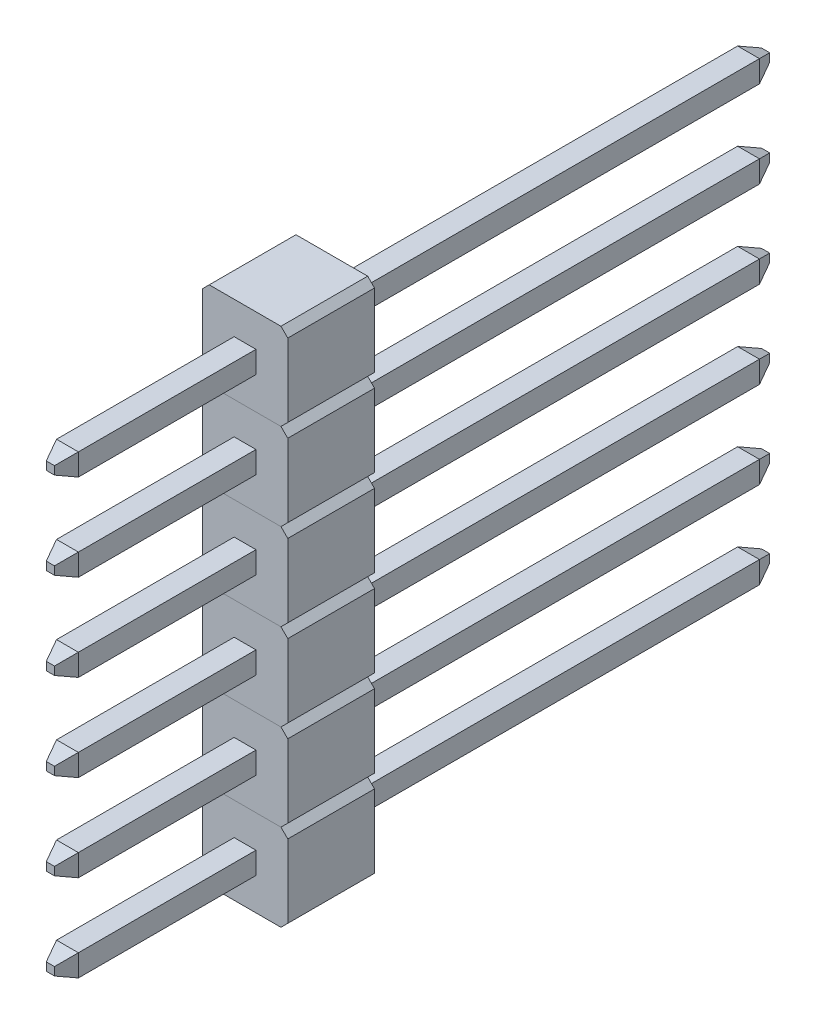
from build123d import *
from OCP.BRepFilletAPI import BRepFilletAPI_MakeChamfer

# Parameters (mm, degrees)
ESQUISSE1_W                = 2.5
ESQUISSE1_H                = 2.54
BASE_DEPTH                 = 2.54
ESQUISSE3_W                = 0.64
ESQUISSE3_H                = 0.64
EXTRUDE_A_DEPTH            = 5.7
ESQUISSE4_W                = 0.64
ESQUISSE4_H                = 0.64
EXTRUDE_B_DEPTH            = 12.7
CHANFREIN2_SIZE            = 0.2
CHANFREIN3_SIZE            = 0.5
CHANFREIN3_SIZE2           = 0.2
R_P_TITION_LIN_AIRE2_COUNT = 6
R_P_TITION_LIN_AIRE2_PITCH = 2.54


with BuildPart() as part:
    # Esquisse1 → Base (new body)
    with BuildSketch(Plane.XY):
        Rectangle(ESQUISSE1_W, ESQUISSE1_H)
    extrude(amount=BASE_DEPTH)

    # Esquisse3 → A (add)
    with BuildSketch(Plane.XY.offset(2.54)):
        Rectangle(ESQUISSE3_W, ESQUISSE3_H)
    extrude(amount=EXTRUDE_A_DEPTH)

    # Esquisse4 → B (add)
    with BuildSketch(Plane(origin=(0, 0, 0), x_dir=(-1, 0, 0), z_dir=(0, 0, -1))):
        Rectangle(ESQUISSE4_W, ESQUISSE4_H)
    extrude(amount=EXTRUDE_B_DEPTH)

    # Chanfrein2
    chanfrein2_edges = [part.edges().sort_by_distance(p)[0] for p in [
        (1.25, -1.27, 1.27),
        (-1.25, -1.27, 1.27),
        (-1.25, 1.27, 1.27),
        (1.25, 1.27, 1.27),
    ]]
    chamfer(chanfrein2_edges, length=CHANFREIN2_SIZE)

    # Chanfrein3: one chamfer whose edges measure the first distance from different faces: ONE call of the kernel's chamfer builder (chamfer() names one face for all edges)
    chanfrein3_edges_1 = [part.edges().sort_by_distance(p)[0] for p in [
        (0.32, 0, 8.24),
    ]]
    chanfrein3_side_1 = [part.faces().sort_by_distance(p)[0] for p in [
        (0.32, 0, 5.39),
    ]]
    chanfrein3_edges_2 = [part.edges().sort_by_distance(p)[0] for p in [
        (0, 0.32, 8.24),
    ]]
    chanfrein3_side_2 = [part.faces().sort_by_distance(p)[0] for p in [
        (0, 0.32, 5.39),
    ]]
    chanfrein3_edges_3 = [part.edges().sort_by_distance(p)[0] for p in [
        (-0.32, 0, 8.24),
    ]]
    chanfrein3_side_3 = [part.faces().sort_by_distance(p)[0] for p in [
        (-0.32, 0, 5.39),
    ]]
    chanfrein3_edges_4 = [part.edges().sort_by_distance(p)[0] for p in [
        (0, -0.32, 8.24),
    ]]
    chanfrein3_side_4 = [part.faces().sort_by_distance(p)[0] for p in [
        (0, -0.32, 5.39),
    ]]
    chanfrein3_edges_5 = [part.edges().sort_by_distance(p)[0] for p in [
        (-0.32, 0, -12.7),
    ]]
    chanfrein3_side_5 = [part.faces().sort_by_distance(p)[0] for p in [
        (-0.32, 0, -6.35),
    ]]
    chanfrein3_edges_6 = [part.edges().sort_by_distance(p)[0] for p in [
        (0, 0.32, -12.7),
    ]]
    chanfrein3_side_6 = [part.faces().sort_by_distance(p)[0] for p in [
        (0, 0.32, -6.35),
    ]]
    chanfrein3_edges_7 = [part.edges().sort_by_distance(p)[0] for p in [
        (0.32, 0, -12.7),
    ]]
    chanfrein3_side_7 = [part.faces().sort_by_distance(p)[0] for p in [
        (0.32, 0, -6.35),
    ]]
    chanfrein3_edges_8 = [part.edges().sort_by_distance(p)[0] for p in [
        (0, -0.32, -12.7),
    ]]
    chanfrein3_side_8 = [part.faces().sort_by_distance(p)[0] for p in [
        (0, -0.32, -6.35),
    ]]
    chanfrein3 = BRepFilletAPI_MakeChamfer(part.part.solid().wrapped)
    for e in chanfrein3_edges_1:
        chanfrein3.Add(CHANFREIN3_SIZE, CHANFREIN3_SIZE2, e.wrapped, chanfrein3_side_1[0].wrapped)  # the first distance lies on this face
    for e in chanfrein3_edges_2:
        chanfrein3.Add(CHANFREIN3_SIZE, CHANFREIN3_SIZE2, e.wrapped, chanfrein3_side_2[0].wrapped)  # the first distance lies on this face
    for e in chanfrein3_edges_3:
        chanfrein3.Add(CHANFREIN3_SIZE, CHANFREIN3_SIZE2, e.wrapped, chanfrein3_side_3[0].wrapped)  # the first distance lies on this face
    for e in chanfrein3_edges_4:
        chanfrein3.Add(CHANFREIN3_SIZE, CHANFREIN3_SIZE2, e.wrapped, chanfrein3_side_4[0].wrapped)  # the first distance lies on this face
    for e in chanfrein3_edges_5:
        chanfrein3.Add(CHANFREIN3_SIZE, CHANFREIN3_SIZE2, e.wrapped, chanfrein3_side_5[0].wrapped)  # the first distance lies on this face
    for e in chanfrein3_edges_6:
        chanfrein3.Add(CHANFREIN3_SIZE, CHANFREIN3_SIZE2, e.wrapped, chanfrein3_side_6[0].wrapped)  # the first distance lies on this face
    for e in chanfrein3_edges_7:
        chanfrein3.Add(CHANFREIN3_SIZE, CHANFREIN3_SIZE2, e.wrapped, chanfrein3_side_7[0].wrapped)  # the first distance lies on this face
    for e in chanfrein3_edges_8:
        chanfrein3.Add(CHANFREIN3_SIZE, CHANFREIN3_SIZE2, e.wrapped, chanfrein3_side_8[0].wrapped)  # the first distance lies on this face
    add(Compound.cast(chanfrein3.Shape()), mode=Mode.REPLACE)


with BuildPart() as r_p_tition_lin_aire2_1:
    # Répétition linéaire2: pattern copy
    add(part.part.moved(Location(Vector(0, 1, 0) * (1 * R_P_TITION_LIN_AIRE2_PITCH))))


with BuildPart() as r_p_tition_lin_aire2_2:
    # Répétition linéaire2: pattern copy
    add(part.part.moved(Location(Vector(0, 1, 0) * (2 * R_P_TITION_LIN_AIRE2_PITCH))))


with BuildPart() as r_p_tition_lin_aire2_3:
    # Répétition linéaire2: pattern copy
    add(part.part.moved(Location(Vector(0, 1, 0) * (3 * R_P_TITION_LIN_AIRE2_PITCH))))


with BuildPart() as r_p_tition_lin_aire2_4:
    # Répétition linéaire2: pattern copy
    add(part.part.moved(Location(Vector(0, 1, 0) * (4 * R_P_TITION_LIN_AIRE2_PITCH))))


with BuildPart() as r_p_tition_lin_aire2_5:
    # Répétition linéaire2: pattern copy
    add(part.part.moved(Location(Vector(0, 1, 0) * (5 * R_P_TITION_LIN_AIRE2_PITCH))))


solid = Compound([part.part, r_p_tition_lin_aire2_1.part, r_p_tition_lin_aire2_2.part, r_p_tition_lin_aire2_3.part, r_p_tition_lin_aire2_4.part, r_p_tition_lin_aire2_5.part])
